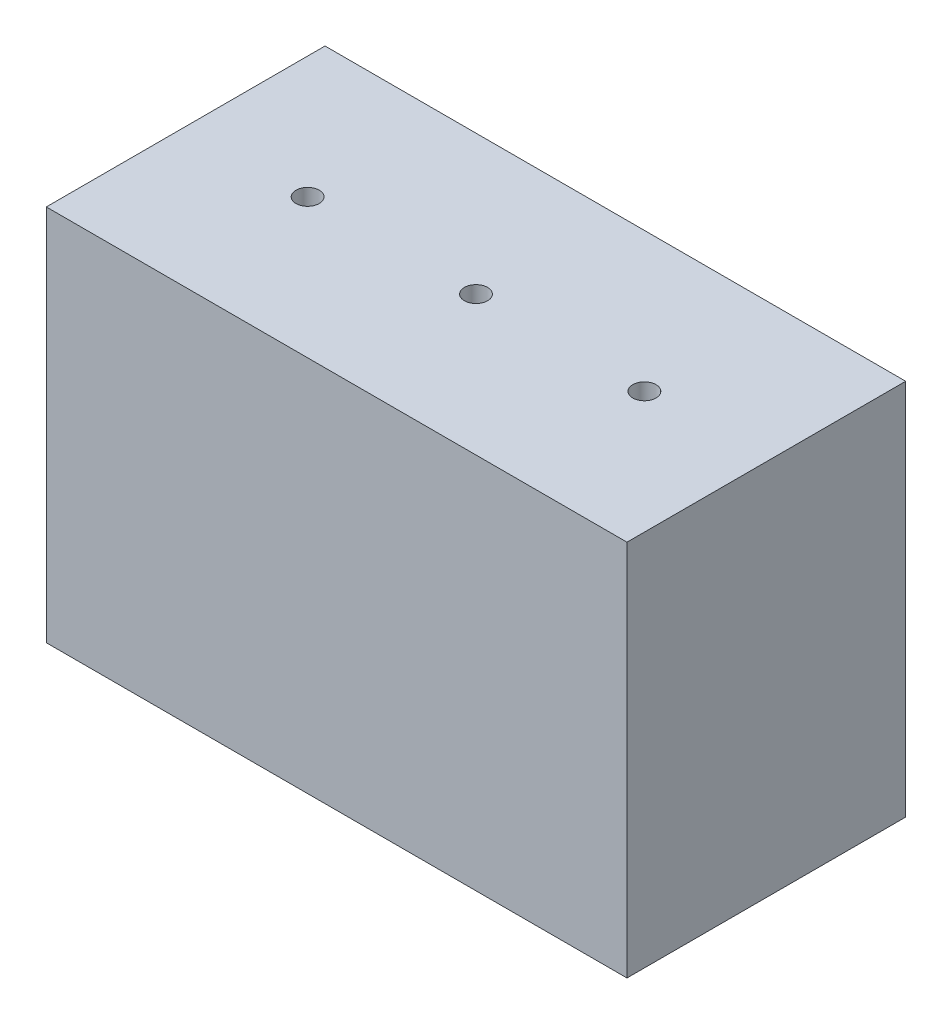
from build123d import *

# Parameters (mm, degrees)
SKETCH2_W           = 100
SKETCH2_H           = 48
SKETCH2_R           = 2
BOSS_EXTRUDE1_DEPTH = 65


with BuildPart() as part:
    # Sketch2 → Boss-Extrude1 (new body)
    with BuildSketch(Plane(origin=(0, 0, 0), x_dir=(1, 0, 0), z_dir=(0, 1, 0))):
        Rectangle(SKETCH2_W, SKETCH2_H)
        with Locations(Location((-29, 0, 0), (0, 0, 270))):
            Circle(SKETCH2_R, mode=Mode.SUBTRACT)
        with Locations(Location((0, 0, 0), (0, 0, 270))):
            Circle(SKETCH2_R, mode=Mode.SUBTRACT)
        with Locations(Location((29, 0, 0), (0, 0, 270))):
            Circle(SKETCH2_R, mode=Mode.SUBTRACT)
    extrude(amount=-BOSS_EXTRUDE1_DEPTH)


solid = part.part
